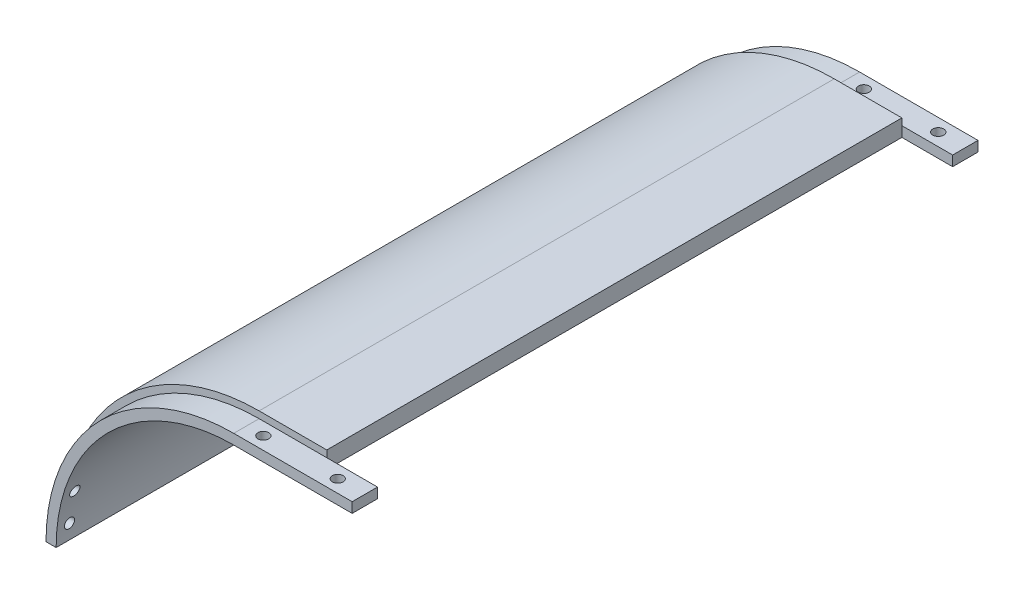
from build123d import *

# Parameters (mm, degrees)
BOSS_EXTRUDE1_DEPTH = 92.5
SKETCH2_R           = 1.5
CUT_EXTRUDE1_DEPTH  = 161.2146997
SKETCH4_R           = 1.6
CUT_EXTRUDE2_DEPTH  = 161.214699867
CUT_EXTRUDE3_DEPTH  = 7.5
CUT_EXTRUDE5_DEPTH  = 7.5


with BuildPart() as part:
    # Sketch1 → Boss-Extrude1 (new, symmetric)
    with BuildSketch(Plane.XY):
        with BuildLine():
            ThreePointArc((117.5, 0), (100.658639918, 40.658639918), (60, 57.5))
            Line((60, 57.5), (-60, 57.5))
            ThreePointArc((-60, 57.5), (-100.658639918, 40.658639918), (-117.5, 0))
            Line((-117.5, 0), (-112.5, 0))
            ThreePointArc((-112.5, 0), (-112.485698596, 1.22533379), (-112.442802175, 2.45))
            ThreePointArc((-112.442802175, 2.45), (-112.306489538, 4.503460029), (-112.089802265, 6.55))
            ThreePointArc((-112.089802265, 6.55), (-111.721057974, 9.010114432), (-111.236193262, 11.45))
            ThreePointArc((-111.236193262, 11.45), (-110.731665892, 13.511035335), (-110.144266871, 15.55))
            ThreePointArc((-110.144266871, 15.55), (-91.143819612, 42.264790311), (-60, 52.5))
            Line((-60, 52.5), (-57.05, 52.5))
            Line((-57.05, 52.5), (-52.95, 52.5))
            Line((-52.95, 52.5), (-35.05, 52.5))
            Line((-35.05, 52.5), (-30.95, 52.5))
            Line((-30.95, 52.5), (-13.05, 52.5))
            Line((-13.05, 52.5), (-8.95, 52.5))
            Line((-8.95, 52.5), (8.95, 52.5))
            Line((8.95, 52.5), (13.05, 52.5))
            Line((13.05, 52.5), (30.95, 52.5))
            Line((30.95, 52.5), (35.05, 52.5))
            Line((35.05, 52.5), (52.95, 52.5))
            Line((52.95, 52.5), (57.05, 52.5))
            Line((57.05, 52.5), (60, 52.5))
            ThreePointArc((60, 52.5), (91.143819612, 42.264790311), (110.144266871, 15.55))
            ThreePointArc((110.144266871, 15.55), (110.731665892, 13.511035335), (111.236193262, 11.45))
            ThreePointArc((111.236193262, 11.45), (111.721057974, 9.010114432), (112.089802265, 6.55))
            ThreePointArc((112.089802265, 6.55), (112.306489538, 4.503460029), (112.442802175, 2.45))
            ThreePointArc((112.442802175, 2.45), (112.485698596, 1.22533379), (112.5, 0))
            Line((112.5, 0), (117.5, 0))
        make_face()
    extrude(amount=BOSS_EXTRUDE1_DEPTH, both=True)

    # Sketch2 → Cut-Extrude1 (cut, symmetric)
    with BuildSketch(Plane(origin=(0, 0, 0), x_dir=(0, 0, -1), z_dir=(1, 0, 0))):
        with Locations((-88.75, 4.5)):
            Circle(SKETCH2_R)
        with Locations((-88.75, 13.5)):
            Circle(SKETCH2_R)
    cut_extrude1 = extrude(amount=CUT_EXTRUDE1_DEPTH, both=True, mode=Mode.SUBTRACT)

    # Sketch4 → Cut-Extrude2 (cut, symmetric)
    with BuildSketch(Plane(origin=(0, 57.5, 0), x_dir=(1, 0, 0), z_dir=(0, 1, 0))):
        with Locations(Location((-55, -88.75, 0), (0, 0, 270))):
            Circle(SKETCH4_R)
        with Locations(Location((-33, -88.75, 0), (0, 0, 270))):
            Circle(SKETCH4_R)
        with Locations(Location((-11, -88.75, 0), (0, 0, 270))):
            Circle(SKETCH4_R)
        with Locations(Location((11, -88.75, 0), (0, 0, 270))):
            Circle(SKETCH4_R)
        with Locations(Location((33, -88.75, 0), (0, 0, 270))):
            Circle(SKETCH4_R)
        with Locations(Location((55, -88.75, 0), (0, 0, 270))):
            Circle(SKETCH4_R)
    cut_extrude2 = extrude(amount=CUT_EXTRUDE2_DEPTH, both=True, mode=Mode.SUBTRACT)

    # Sketch5 → Cut-Extrude3 (cut)
    with BuildSketch(Plane(origin=(0, 0, -92.5), x_dir=(-1, 0, 0), z_dir=(0, 0, -1))):
        with BuildLine():
            Line((115.5, 0), (117.5, 0))
            ThreePointArc((117.5, 0), (100.658639918, 40.658639918), (60, 57.5))
            Line((60, 57.5), (-60, 57.5))
            ThreePointArc((-60, 57.5), (-100.658639918, 40.658639918), (-117.5, 0))
            Line((-117.5, 0), (-115.5, 0))
            ThreePointArc((-115.5, 0), (-99.244426356, 39.244426356), (-60, 55.5))
            Line((-60, 55.5), (60, 55.5))
            ThreePointArc((60, 55.5), (99.244426356, 39.244426356), (115.5, 0))
        make_face()
    cut_extrude3 = extrude(amount=-CUT_EXTRUDE3_DEPTH, mode=Mode.SUBTRACT)

    # Mirror1: Cut-Extrude1, Cut-Extrude2, Cut-Extrude3 across plane
    add(cut_extrude1.mirror(Plane.XY), mode=Mode.SUBTRACT)
    add(cut_extrude2.mirror(Plane.XY), mode=Mode.SUBTRACT)
    add(cut_extrude3.mirror(Plane.XY), mode=Mode.SUBTRACT)

    # Sketch6 → Cut-Extrude5 (cut)
    with BuildSketch(Plane(origin=(0, 57.5, 0), x_dir=(1, 0, 0), z_dir=(0, 1, 0))):
        Polygon((-40, 85), (-25, 85), (-25, 92.5), (25, 92.5), (25, 85), (40, 85), (40, -85), (25, -85), (25, -92.5), (-25, -92.5), (-25, -85), (-40, -85), align=None)
    extrude(amount=-CUT_EXTRUDE5_DEPTH, mode=Mode.SUBTRACT)


with BuildPart() as body_2:
    # of the pieces the cut leaves, the one that is kept (cut_extrude5_keep)
    add(part.part.solids().sort_by_distance((-25, 55.5, -92.5))[0])


solid = body_2.part
